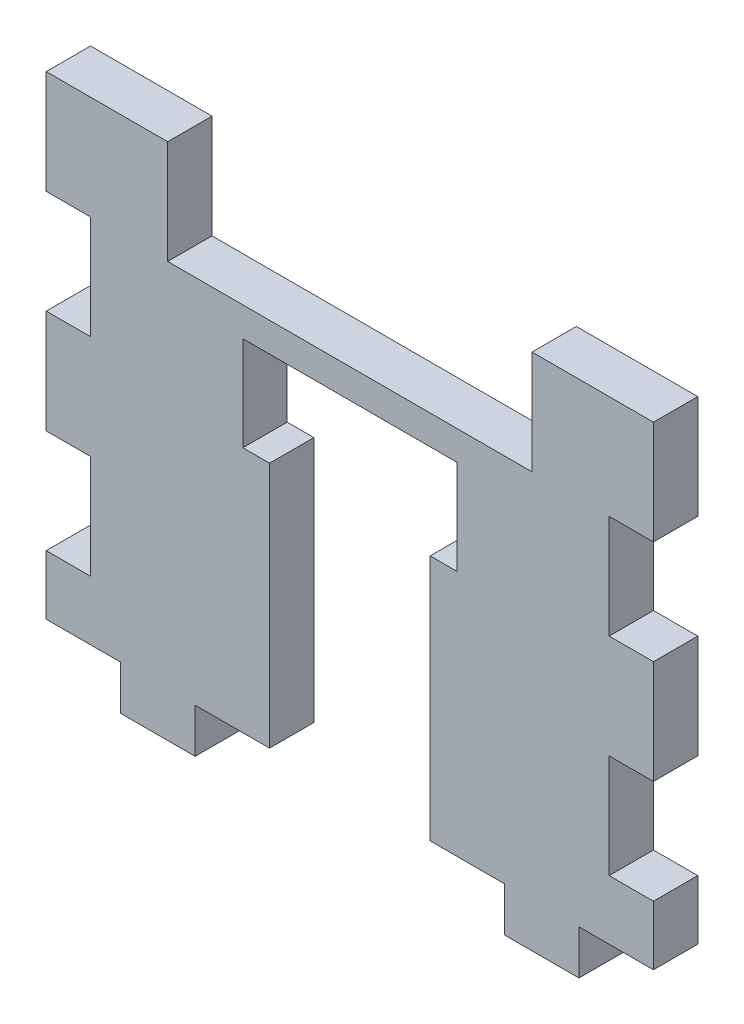
from build123d import *

# Parameters (mm, degrees)
BOSS_EXTRUDE1_DEPTH = 4.5593


with BuildPart() as part:
    # Sketch1 → Boss-Extrude1 (new body)
    with BuildSketch(Plane.XY):
        Polygon((-31.2293, -16.002), (-31.2293, -22.1107), (-23.571940833, -22.1107), (-23.571940833, -26.67), (-15.914581667, -26.67), (-15.914581667, -22.1107), (-8.2572225, -22.1107), (-8.2572225, 3.27152), (-11.00963, 3.27152), (-11.00963, 12.9921), (11.00963, 12.9921), (11.00963, 3.27152), (8.2572225, 3.27152), (8.2572225, -22.1107), (15.914581667, -22.1107), (15.914581667, -26.67), (23.571940833, -26.67), (23.571940833, -22.1107), (31.2293, -22.1107), (31.2293, -16.002), (26.67, -16.002), (26.67, -5.334), (31.2293, -5.334), (31.2293, 5.334), (26.67, 5.334), (26.67, 16.002), (31.2293, 16.002), (31.2293, 26.67), (18.73758, 26.67), (18.73758, 22.1107), (18.73758, 16.002), (-18.73758, 16.002), (-18.73758, 22.1107), (-18.73758, 26.67), (-31.2293, 26.67), (-31.2293, 16.002), (-26.67, 16.002), (-26.67, 5.334), (-31.2293, 5.334), (-31.2293, -5.334), (-26.67, -5.334), (-26.67, -16.002), align=None)
    extrude(amount=BOSS_EXTRUDE1_DEPTH)


solid = part.part
